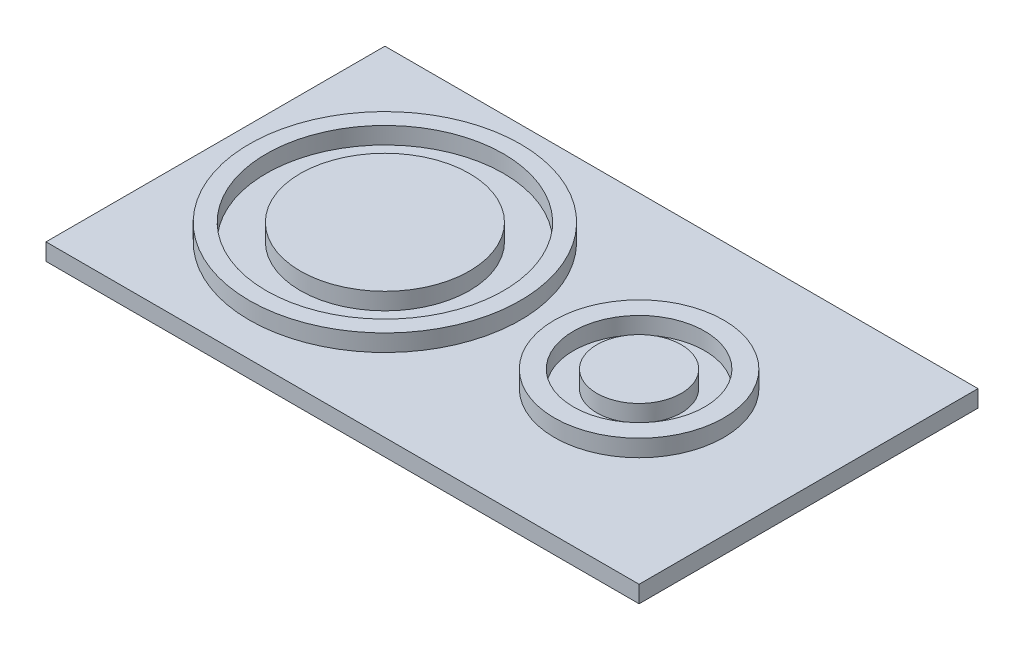
from build123d import *

# Parameters (mm, degrees)
CROQUIS1_W              = 70
CROQUIS1_H              = 40
SALIENTE_EXTRUIR1_DEPTH = 2
CROQUIS2_R              = 16
CROQUIS2_R_2            = 14
CROQUIS2_R_3            = 9.98
CROQUIS2_R_4            = 10
CROQUIS2_R_5            = 7.75
CROQUIS2_R_6            = 4.98
SALIENTE_EXTRUIR2_DEPTH = 2


with BuildPart() as part:
    # Croquis1 → Saliente-Extruir1 (new body)
    with BuildSketch(Plane(origin=(0, 0, 0), x_dir=(1, 0, 0), z_dir=(0, 1, 0))):
        Rectangle(CROQUIS1_W, CROQUIS1_H)
    extrude(amount=SALIENTE_EXTRUIR1_DEPTH)

    # Croquis2 → Saliente-Extruir2 (add)
    # profile 1 of 4: a face of its own
    with BuildSketch(Plane(origin=(0, 2, 0), x_dir=(1, 0, 0), z_dir=(0, 1, 0))):
        with Locations(Location((-15, 0, 0), (0, 0, 90))):
            Circle(CROQUIS2_R)
        with Locations(Location((-15, 0, 0), (0, 0, 270))):
            Circle(CROQUIS2_R_2, mode=Mode.SUBTRACT)
    # profile 2 of 4: a face of its own
    with BuildSketch(Plane(origin=(0, 2, 0), x_dir=(1, 0, 0), z_dir=(0, 1, 0))):
        with Locations(Location((-15, 0, 0), (0, 0, 90))):
            Circle(CROQUIS2_R_3)
    # profile 3 of 4: a face of its own
    with BuildSketch(Plane(origin=(0, 2, 0), x_dir=(1, 0, 0), z_dir=(0, 1, 0))):
        with Locations(Location((15, 0, 0), (0, 0, 90))):
            Circle(CROQUIS2_R_4)
        with Locations(Location((15, 0, 0), (0, 0, 270))):
            Circle(CROQUIS2_R_5, mode=Mode.SUBTRACT)
    # profile 4 of 4: a face of its own
    with BuildSketch(Plane(origin=(0, 2, 0), x_dir=(1, 0, 0), z_dir=(0, 1, 0))):
        with Locations(Location((15, 0, 0), (0, 0, 90))):
            Circle(CROQUIS2_R_6)
    extrude(amount=SALIENTE_EXTRUIR2_DEPTH)


solid = part.part
